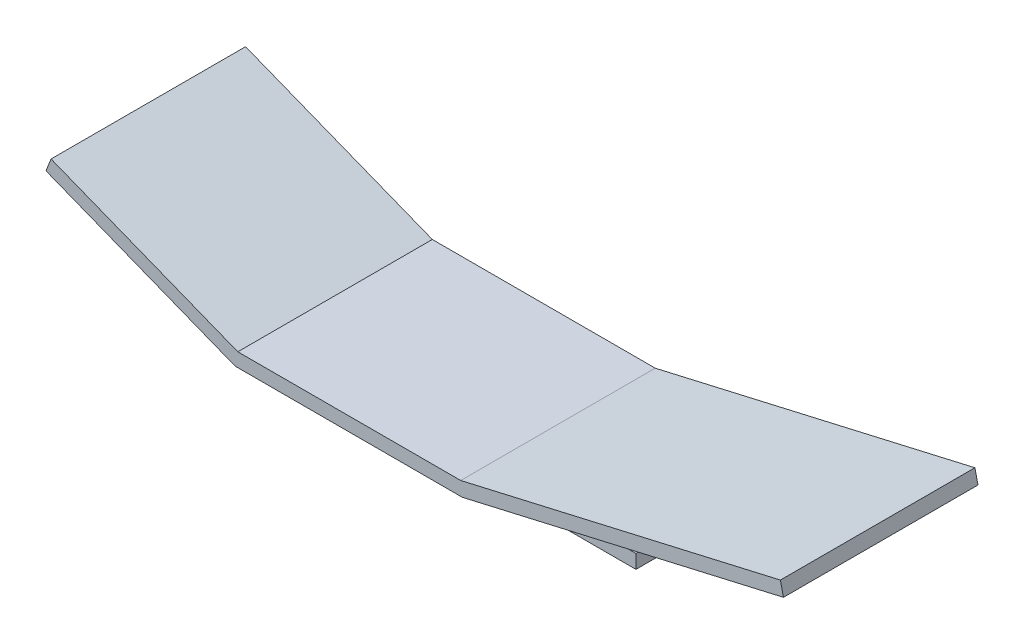
from build123d import *

# Parameters (mm, degrees)
ESBO_O1_W                = 520.649080511
ESBO_O1_H                = 17
RESSALTO_EXTRUS_O1_DEPTH = 30
RESSALTO_EXTRUS_O2_DEPTH = 240


with BuildPart() as part:
    # Esboço1 → Ressalto-extrusão1 (new body)
    with BuildSketch(Plane.XY.offset(30)):
        with Locations((251.289316527, 693.016670883)):
            Rectangle(ESBO_O1_W, ESBO_O1_H)
    extrude(amount=RESSALTO_EXTRUS_O1_DEPTH)


with BuildPart() as body_2:
    # Esboço2 → Ressalto-extrusão2 (new body)
    with BuildSketch(Plane.XY.offset(30)):
        Polygon((0, 972.240013316), (230.401177787, 881.434037576), (505.401177787, 881.434037576), (899.818171461, 972.240013316), (903.632275154, 955.673401924), (507.332852153, 864.434037576), (227.172021003, 864.434037576), (-6.233405118, 956.424051106), align=None)
    extrude(amount=RESSALTO_EXTRUS_O2_DEPTH)


solid = Compound([part.part, body_2.part])
